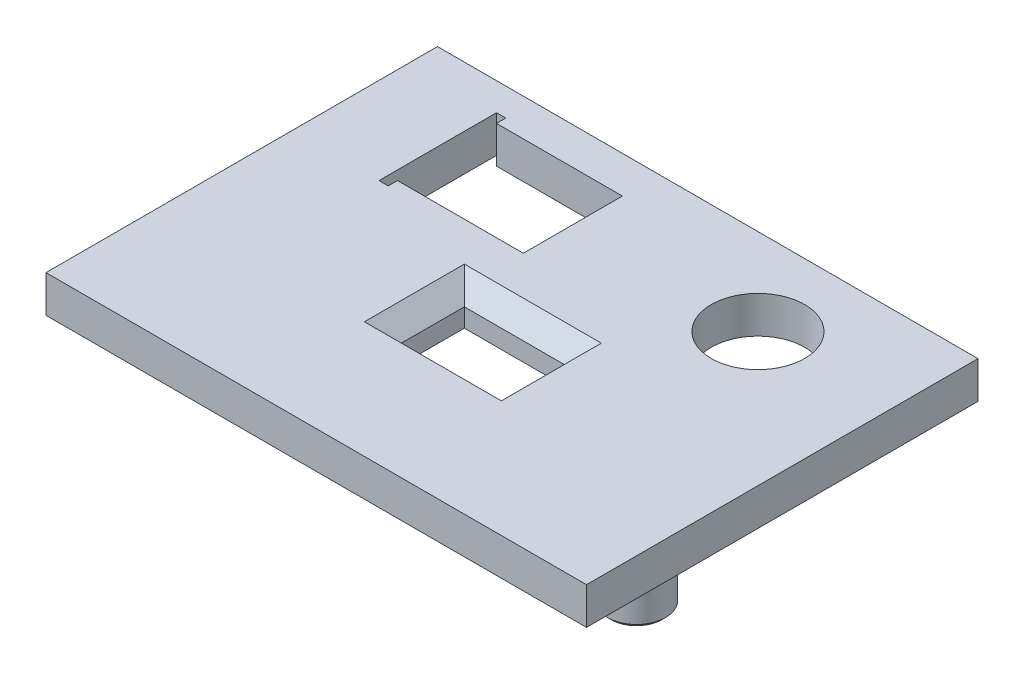
from build123d import *

# Parameters (mm, degrees)
PARTS_W           = 29.2
PARTS_H           = 21.15
MAIN_FACE_DEPTH   = 2
SKETCH3_R         = 2.525
IR_CUT_DEPTH      = 2
TSOP_GROOVE_DEPTH = 1.5
SKETCH4_W         = 5.4
SKETCH4_H         = 3.4
TOF_CUT_DEPTH     = 2
SKETCH6_R         = 1.575
SHAFTS_DEPTH      = 5
CHAMFER1_SIZE     = 0.2
SKETCH7_W         = 15
SKETCH7_H         = 3.5
PINSLOTS_DEPTH    = 1
TOFWINDOW_SIZE    = 1


with BuildPart() as part:
    # Parts → Main Face (new body)
    with BuildSketch(Plane(origin=(0, 0, 0), x_dir=(1, 0, 0), z_dir=(0, 1, 0))):
        with Locations((0, 3.175)):
            Rectangle(PARTS_W, PARTS_H)
    extrude(amount=-MAIN_FACE_DEPTH)

    # Sketch3 → IR Cut (cut)
    with BuildSketch(Plane(origin=(0, 0, 0), x_dir=(1, 0, 0), z_dir=(0, 1, 0))):
        with Locations(Location((7.3875, 9.075, 0), (0, 0, 270))):
            Circle(SKETCH3_R)
        Polygon((-2.6125, 11.75), (-2.6125, 6.4), (-9.4125, 6.4), (-9.4125, 5.9), (-9.9125, 5.9), (-9.9125, 6.4), (-9.9125, 11.75), (-9.9125, 12.25), (-9.4125, 12.25), (-9.4125, 11.75), align=None)
    extrude(amount=-IR_CUT_DEPTH, mode=Mode.SUBTRACT)

    # Sketch5 → TSOP Groove (cut)
    with BuildSketch(Plane.XZ.offset(2)):
        Polygon((-2.6125, -11.75), (-2.6125, -6.4), (-2.6125, -5.9), (1.3875, -5.9), (1.3875, -6.4), (1.3875, -11.75), (1.3875, -12.25), (-2.6125, -12.25), align=None)
    extrude(amount=-TSOP_GROOVE_DEPTH, mode=Mode.SUBTRACT)

    # Sketch4 → TOF Cut (cut)
    with BuildSketch(Plane(origin=(0, 0, 0), x_dir=(1, 0, 0), z_dir=(0, 1, 0))):
        with Locations((0, 1.6)):
            Rectangle(SKETCH4_W, SKETCH4_H)
    extrude(amount=-TOF_CUT_DEPTH, mode=Mode.SUBTRACT)

    # Sketch6 → Shafts (add)
    with BuildSketch(Plane.XZ.offset(2)):
        with Locations(Location((-9.9, 0, 0), (0, 0, 270))):
            Circle(SKETCH6_R)
        with Locations(Location((9.9, 0, 0), (0, 0, 270))):
            Circle(SKETCH6_R)
    extrude(amount=SHAFTS_DEPTH)

    # Chamfer1
    chamfer1_edges = [part.edges().sort_by_distance(p)[0] for p in [
        (9.9, -7, 1.575),
        (-9.9, -7, 1.575),
    ]]
    chamfer(chamfer1_edges, length=CHAMFER1_SIZE)

    # Sketch7 → PinSlots (cut)
    with BuildSketch(Plane.XZ.offset(2)):
        with Locations((0, 3.15)):
            Rectangle(SKETCH7_W, SKETCH7_H)
    extrude(amount=-PINSLOTS_DEPTH, mode=Mode.SUBTRACT)

    # ToFWindow
    tofwindow_edges = [part.edges().sort_by_distance(p)[0] for p in [
        (-2.7, 0, -1.6),
        (0, 0, 0.1),
        (2.7, 0, -1.6),
        (0, 0, -3.3),
    ]]
    chamfer(tofwindow_edges, length=TOFWINDOW_SIZE)


solid = part.part
